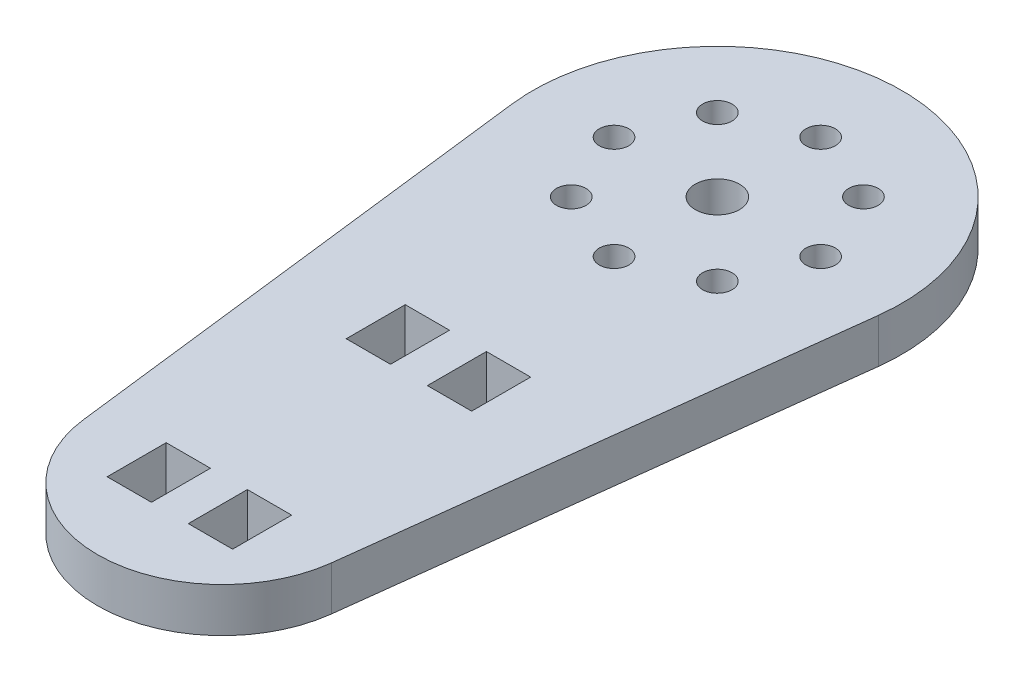
from build123d import *

# Parameters (mm, degrees)
SKETCH1_R           = 1.5
SKETCH1_W           = 3
SKETCH1_H           = 4
BOSS_EXTRUDE2_DEPTH = 3
FILLET1_R           = 8.464107
SKETCH2_R           = 1
CUT_EXTRUDE1_DEPTH  = 3


with BuildPart() as part:
    # Sketch1 → Boss-Extrude2 (new body)
    with BuildSketch(Plane(origin=(0, 0, 0), x_dir=(1, 0, 0), z_dir=(0, 1, 0))):
        with BuildLine():
            Line((-7.5, -42), (-12.409150917, -1.504318289))
            ThreePointArc((-12.409150917, -1.504318289), (0, 12.5), (12.409150917, -1.504318289))
            Line((12.409150917, -1.504318289), (7.5, -42))
            Line((7.5, -42), (-7.5, -42))
        make_face()
        with Locations(Location((0, 0, 0), (0, 0, 270))):
            Circle(SKETCH1_R, mode=Mode.SUBTRACT)
        with Locations((2.75, -18.9)):
            Rectangle(SKETCH1_W, SKETCH1_H, mode=Mode.SUBTRACT)
        with Locations((-2.75, -18.9)):
            Rectangle(SKETCH1_W, SKETCH1_H, mode=Mode.SUBTRACT)
        with Locations((2.75, -35.1)):
            Rectangle(SKETCH1_W, SKETCH1_H, mode=Mode.SUBTRACT)
        with Locations((-2.75, -35.1)):
            Rectangle(SKETCH1_W, SKETCH1_H, mode=Mode.SUBTRACT)
    extrude(amount=BOSS_EXTRUDE2_DEPTH)

    # Fillet1
    fillet1_edges = [part.edges().sort_by_distance(p)[0] for p in [
        (7.5, 1.5, 42),
        (-7.5, 1.5, 42),
    ]]
    fillet(fillet1_edges, radius=FILLET1_R)

    # Sketch2 → Cut-Extrude1 (cut)
    with BuildSketch(Plane(origin=(0, 3, 0), x_dir=(1, 0, 0), z_dir=(0, 1, 0))):
        with Locations(Location((0, 7, 0), (0, 0, 270))):
            Circle(SKETCH2_R)
        with Locations(Location((4.949747468, 4.949747468, 0), (0, 0, 270))):
            Circle(SKETCH2_R)
        with Locations(Location((7, 0, 0), (0, 0, 270))):
            Circle(SKETCH2_R)
        with Locations(Location((4.949747468, -4.949747468, 0), (0, 0, 270))):
            Circle(SKETCH2_R)
        with Locations(Location((0, -7, 0), (0, 0, 270))):
            Circle(SKETCH2_R)
        with Locations(Location((-4.949747468, -4.949747468, 0), (0, 0, 270))):
            Circle(SKETCH2_R)
        with Locations(Location((-7, 0, 0), (0, 0, 270))):
            Circle(SKETCH2_R)
        with Locations(Location((-4.949747468, 4.949747468, 0), (0, 0, 270))):
            Circle(SKETCH2_R)
    extrude(amount=-CUT_EXTRUDE1_DEPTH, mode=Mode.SUBTRACT)


solid = part.part
